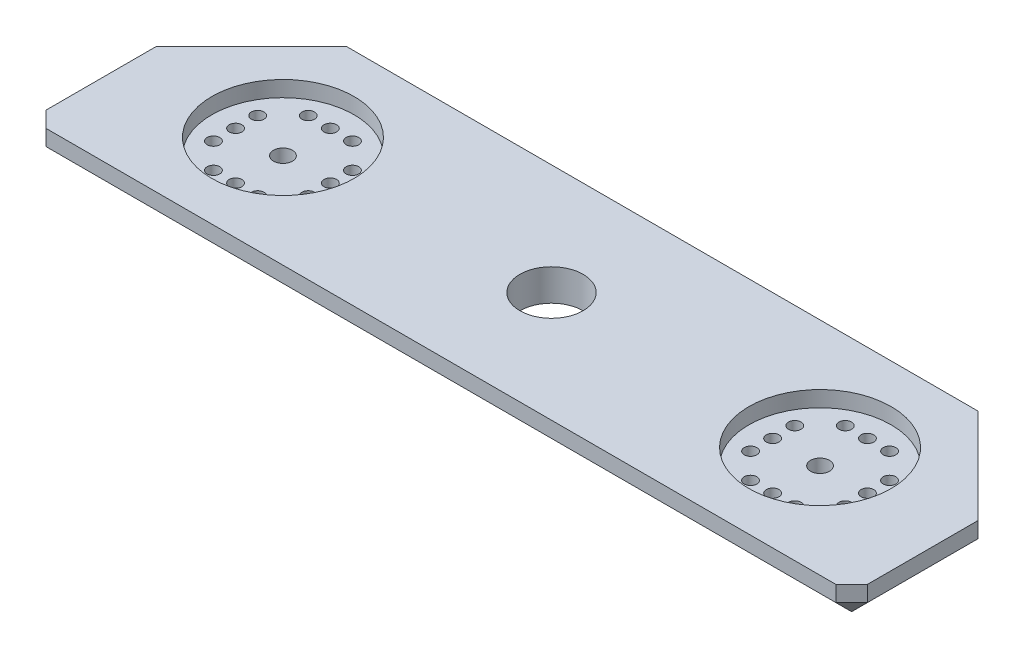
from build123d import *

# Parameters (mm, degrees)
BOSS_EXTRUDE1_DEPTH = 5
SKETCH2_R           = 11.25
CUT_EXTRUDE1_DEPTH  = 2.5
SKETCH3_R           = 1.5
SKETCH3_R_2         = 1
CUT_EXTRUDE3_DEPTH  = 12.5
CHAMFER1_SIZE       = 2.5
SKETCH5_R           = 5
CUT_EXTRUDE4_DEPTH  = 12.5


with BuildPart() as part:
    # Sketch1 → Boss-Extrude1 (new body)
    with BuildSketch(Plane(origin=(0, 0, 0), x_dir=(1, 0, 0), z_dir=(0, 1, 0))):
        Polygon((-65, 2.5), (-65, -17.5), (65, -17.5), (65, 2.5), (50, 17.5), (-50, 17.5), align=None)
    extrude(amount=BOSS_EXTRUDE1_DEPTH)

    # Sketch2 → Cut-Extrude1 (cut)
    with BuildSketch(Plane(origin=(0, 5, 0), x_dir=(1, 0, 0), z_dir=(0, 1, 0))):
        with Locations(Location((-42.5, 0, 0), (0, 0, 270))):
            Circle(SKETCH2_R)
        with Locations(Location((42.5, 0, 0), (0, 0, 90))):
            Circle(SKETCH2_R)
    extrude(amount=-CUT_EXTRUDE1_DEPTH, mode=Mode.SUBTRACT)

    # Sketch3 → Cut-Extrude3 (cut)
    with BuildSketch(Plane(origin=(0, 5, 0), x_dir=(1, 0, 0), z_dir=(0, 1, 0))):
        with Locations(Location((42.5, 0, 0), (0, 0, 270))):
            Circle(SKETCH3_R)
        with Locations(Location((42.5, 7.5, 0), (0, 0, 270))):
            Circle(SKETCH3_R_2)
        with Locations(Location((46, 7.5, 0), (0, 0, 270))):
            Circle(SKETCH3_R_2)
        with Locations(Location((39, 7.5, 0), (0, 0, 270))):
            Circle(SKETCH3_R_2)
        with Locations(Location((50, 3.5, 0), (0, 0, 270))):
            Circle(SKETCH3_R_2)
        with Locations(Location((50, 0, 0), (0, 0, 270))):
            Circle(SKETCH3_R_2)
        with Locations(Location((50, -3.5, 0), (0, 0, 270))):
            Circle(SKETCH3_R_2)
        with Locations(Location((46, -7.5, 0), (0, 0, 270))):
            Circle(SKETCH3_R_2)
        with Locations(Location((42.5, -7.5, 0), (0, 0, 270))):
            Circle(SKETCH3_R_2)
        with Locations(Location((39, -7.5, 0), (0, 0, 270))):
            Circle(SKETCH3_R_2)
        with Locations(Location((35, -3.5, 0), (0, 0, 270))):
            Circle(SKETCH3_R_2)
        with Locations(Location((35, 0, 0), (0, 0, 270))):
            Circle(SKETCH3_R_2)
        with Locations(Location((35, 3.5, 0), (0, 0, 270))):
            Circle(SKETCH3_R_2)
        with Locations(Location((-35, 3.5, 0), (0, 0, 270))):
            Circle(SKETCH3_R_2)
        with Locations(Location((-35, 0, 0), (0, 0, 270))):
            Circle(SKETCH3_R_2)
        with Locations(Location((-35, -3.5, 0), (0, 0, 270))):
            Circle(SKETCH3_R_2)
        with Locations(Location((-39, -7.5, 0), (0, 0, 270))):
            Circle(SKETCH3_R_2)
        with Locations(Location((-42.5, -7.5, 0), (0, 0, 270))):
            Circle(SKETCH3_R_2)
        with Locations(Location((-46, -7.5, 0), (0, 0, 270))):
            Circle(SKETCH3_R_2)
        with Locations(Location((-50, -3.5, 0), (0, 0, 270))):
            Circle(SKETCH3_R_2)
        with Locations(Location((-50, 0, 0), (0, 0, 270))):
            Circle(SKETCH3_R_2)
        with Locations(Location((-50, 3.5, 0), (0, 0, 270))):
            Circle(SKETCH3_R_2)
        with Locations(Location((-39, 7.5, 0), (0, 0, 270))):
            Circle(SKETCH3_R_2)
        with Locations(Location((-46, 7.5, 0), (0, 0, 270))):
            Circle(SKETCH3_R_2)
        with Locations(Location((-42.5, 7.5, 0), (0, 0, 270))):
            Circle(SKETCH3_R_2)
        with Locations(Location((-42.5, 0, 0), (0, 0, 270))):
            Circle(SKETCH3_R)
    extrude(amount=-CUT_EXTRUDE3_DEPTH, mode=Mode.SUBTRACT)

    # Chamfer1
    chamfer1_edges = [part.edges().sort_by_distance(p)[0] for p in [
        (57.5, 0, -10),
        (65, 0, 7.5),
        (65, 2.5, 17.5),
        (-65, 2.5, 17.5),
        (0, 0, 17.5),
        (-65, 0, 7.5),
        (-57.5, 0, -10),
        (0, 0, -17.5),
    ]]
    chamfer(chamfer1_edges, length=CHAMFER1_SIZE)

    # Sketch5 → Cut-Extrude4 (cut)
    with BuildSketch(Plane(origin=(0, 5, 0), x_dir=(1, 0, 0), z_dir=(0, 1, 0))):
        with Locations(Location((0, 0, 0), (0, 0, 270))):
            Circle(SKETCH5_R)
    extrude(amount=-CUT_EXTRUDE4_DEPTH, mode=Mode.SUBTRACT)


solid = part.part
